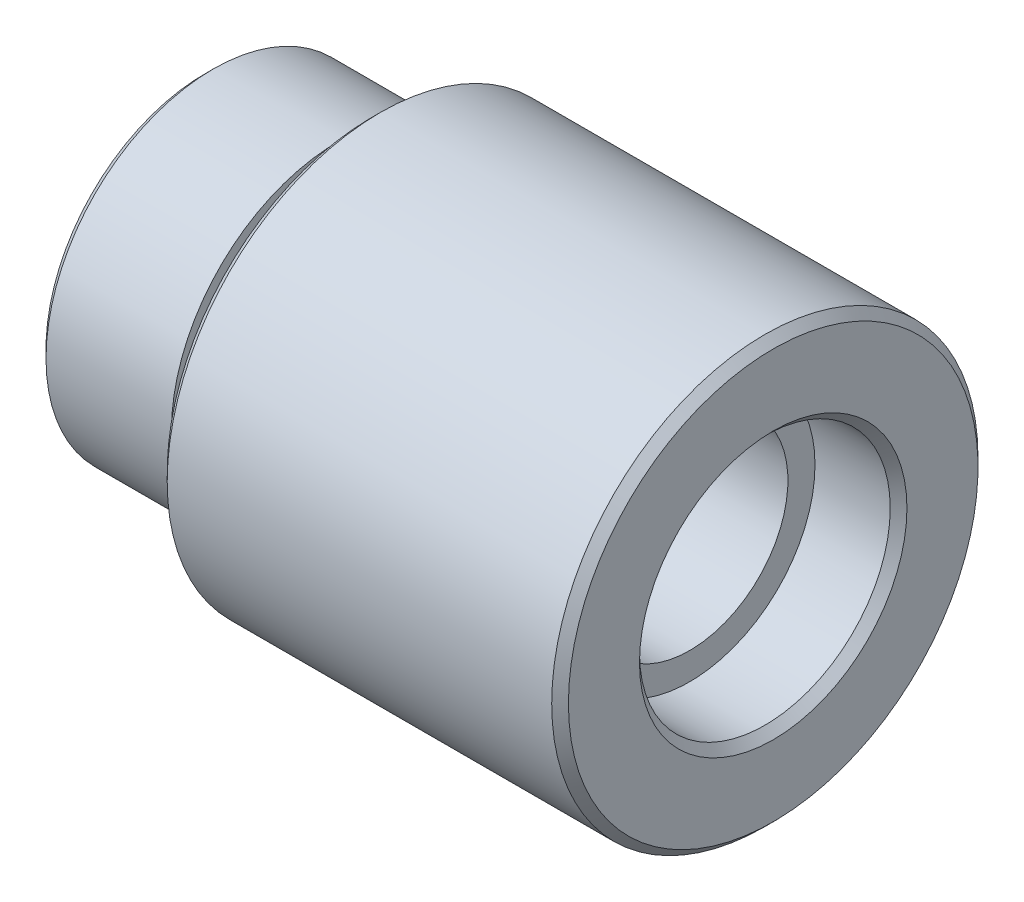
from build123d import *

# Parameters (mm, degrees)
CHANFREIN1_SIZE = 0.5


with BuildPart() as part:
    # Esquisse1 → Base-Révolution (revolve)
    with BuildSketch(Plane.XY, mode=Mode.PRIVATE) as base_r_volution_sk:
        Polygon((0, 7.5), (5, 7.5), (5, 5.88), (29, 5.88), (29, 7.5), (34, 7.5), (34, 12.75), (10, 12.75), (10, 9.25), (8, 9.25), (8, 10), (0, 10), align=None)
    revolve(base_r_volution_sk.sketch.rotate(Axis((0, 0, 0), (1, 0, 0)), 90), axis=Axis((0, 0, 0), (1, 0, 0)))

    # Chanfrein1
    chanfrein1_edges = [part.edges().sort_by_distance(p)[0] for p in [
        (10, 0, -12.75),
        (0, 0, -10),
        (0, 0, -7.5),
        (34, 0, -7.5),
        (34, 0, -12.75),
    ]]
    chamfer(chanfrein1_edges, length=CHANFREIN1_SIZE)


solid = part.part
